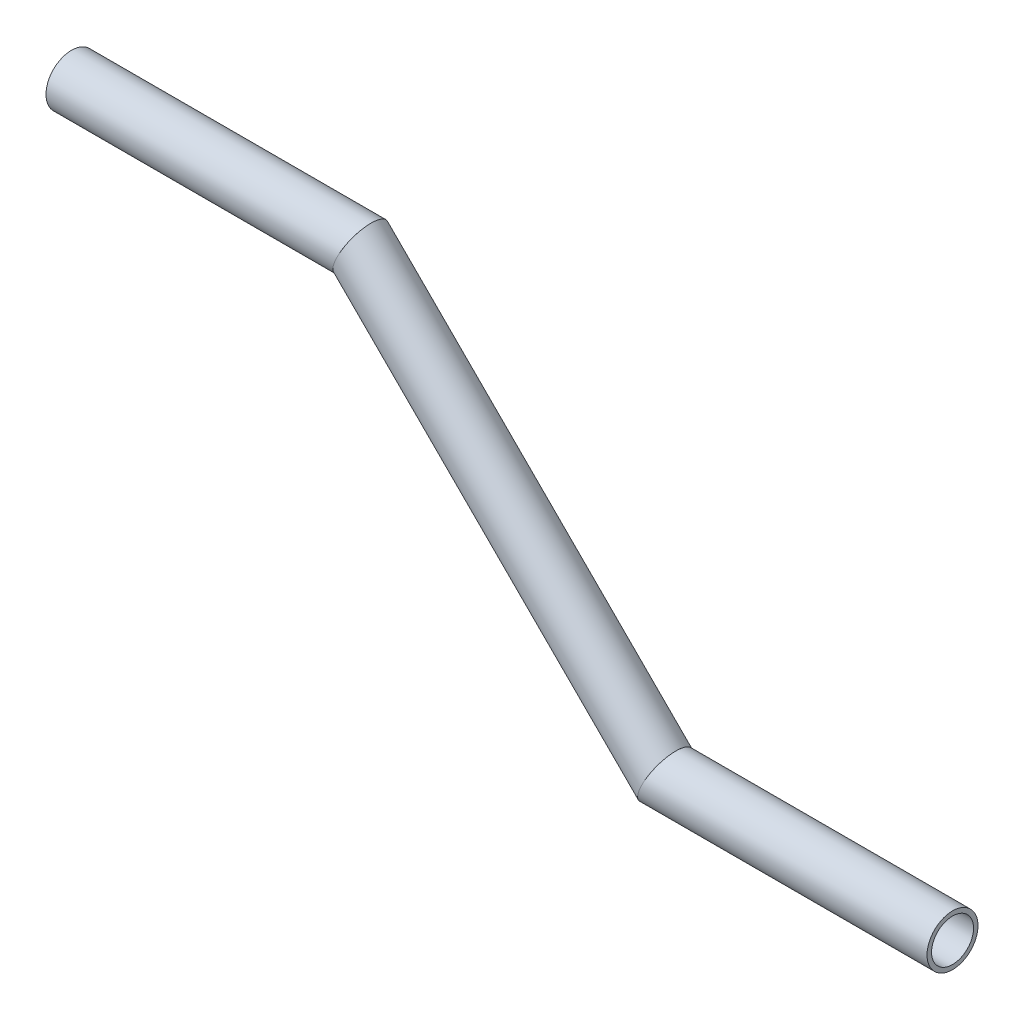
from build123d import *

# Parameters (mm, degrees)
SKETCH1_ON_SEGMENT_1_R         = 3.175
SKETCH1_ON_SEGMENT_1_R_2       = 2.6162
PIPE_0_5_SCH_40_1_DEPTH        = 38.655870397
SKETCH1_ON_SEGMENT_2_R         = 3.175
SKETCH1_ON_SEGMENT_2_R_2       = 2.6162
PIPE_0_5_SCH_40_1_2_DEPTH      = 59.412113138
PIPE_0_5_SCH_40_1_3_DEPTH      = 35.994706883
PIPE_0_5_SCH_40_1_3_DEPTH_BACK = 2.859871939
SKETCH1_R                      = 3.175
SKETCH1_R_2                    = 2.6162


with BuildPart() as part:
    # Sketch1 on segment 1 (carried to segment 1) → Pipe 0.5 SCH 40(1) (new body)
    with BuildSketch(Plane(origin=(-148.488053197, 647.33485556, 0), x_dir=(0, -1, 0), z_dir=(-1, 0, 0))):
        Circle(SKETCH1_ON_SEGMENT_1_R)
        Circle(SKETCH1_ON_SEGMENT_1_R_2, mode=Mode.SUBTRACT)
    extrude(amount=PIPE_0_5_SCH_40_1_DEPTH)

    # Pipe 0.5 SCH 40(1) mitre 1
    split(bisect_by=Plane(origin=(-184.284051655, 647.33485556, 0), x_dir=(0.382683432, 0.923879533, 0), z_dir=(0.923879533, -0.382683432, 0)), keep=Keep.TOP)


with BuildPart() as body_2:
    # Sketch1 on segment 2 (carried to segment 2) → Pipe 0.5 SCH 40_1 2 (new body)
    with BuildSketch(Plane(origin=(-182.261816813, 645.312620718, 0), x_dir=(-0.707106781, -0.707106781, 0), z_dir=(-0.707106781, 0.707106781, 0))):
        Circle(SKETCH1_ON_SEGMENT_2_R)
        Circle(SKETCH1_ON_SEGMENT_2_R_2, mode=Mode.SUBTRACT)
    extrude(amount=PIPE_0_5_SCH_40_1_2_DEPTH)

    # Pipe 0.5 SCH 40_1 2 mitre 1
    split(bisect_by=Plane(origin=(-222.250290056, 685.301093961, 0), x_dir=(0.382683432, 0.923879533, 0), z_dir=(0.923879533, -0.382683432, 0)), keep=Keep.TOP)

    # Pipe 0.5 SCH 40_1 2 mitre 2
    split(bisect_by=Plane(origin=(-184.284051655, 647.33485556, 0), x_dir=(-0.382683432, -0.923879533, 0), z_dir=(-0.923879533, 0.382683432, 0)), keep=Keep.TOP)


with BuildPart() as body_3:
    # Sketch1 → Pipe 0.5 SCH 40_1 3 (new, two sides: drawn at the far end of the back side and taken through both)
    with BuildSketch(Plane(origin=(-222.250290056, 685.301093961, 0), x_dir=(0, -1, 0), z_dir=(-1, 0, 0)).offset(-PIPE_0_5_SCH_40_1_3_DEPTH_BACK)):
        Circle(SKETCH1_R)
        Circle(SKETCH1_R_2, mode=Mode.SUBTRACT)
    extrude(amount=PIPE_0_5_SCH_40_1_3_DEPTH + PIPE_0_5_SCH_40_1_3_DEPTH_BACK)

    # Pipe 0.5 SCH 40_1 3 mitre 1
    split(bisect_by=Plane(origin=(-222.250290056, 685.301093961, 0), x_dir=(-0.382683432, -0.923879533, 0), z_dir=(-0.923879533, 0.382683432, 0)), keep=Keep.TOP)


solid = Compound([part.part, body_2.part, body_3.part])
